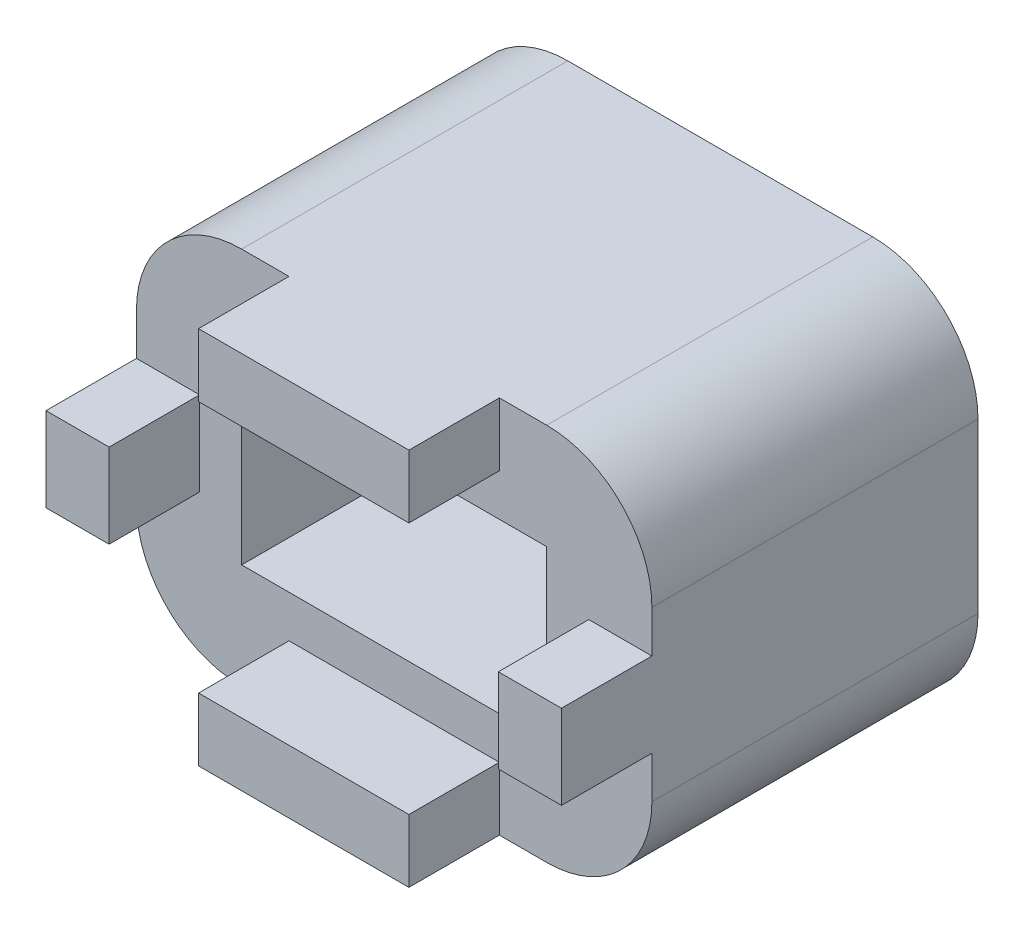
from build123d import *

# Parameters (mm, degrees)
SKETCH1_W           = 24.5
SKETCH1_H           = 18
SKETCH1_W_2         = 14.5
SKETCH1_H_2         = 8
BOSS_EXTRUDE1_DEPTH = 15.5
FILLET1_R           = 5
SKETCH3_W           = 10
SKETCH3_H           = 3
SKETCH3_W_2         = 3
SKETCH3_H_2         = 4
BOSS_EXTRUDE2_DEPTH = 4.3


with BuildPart() as part:
    # Sketch1 → Boss-Extrude1 (new body)
    with BuildSketch(Plane.XY):
        Rectangle(SKETCH1_W, SKETCH1_H)
        Rectangle(SKETCH1_W_2, SKETCH1_H_2, mode=Mode.SUBTRACT)
    extrude(amount=BOSS_EXTRUDE1_DEPTH)

    # Fillet1
    fillet1_edges = [part.edges().sort_by_distance(p)[0] for p in [
        (-12.25, 9, 7.75),
        (12.25, 9, 7.75),
        (12.25, -9, 7.75),
        (-12.25, -9, 7.75),
    ]]
    fillet(fillet1_edges, radius=FILLET1_R)

    # Sketch3 → Boss-Extrude2 (add)
    with BuildSketch(Plane.XY.offset(15.5)):
        with Locations((0, -7.5)):
            Rectangle(SKETCH3_W, SKETCH3_H)
        with Locations((0, 7.5)):
            Rectangle(SKETCH3_W, SKETCH3_H)
        with Locations((-10.75, 0)):
            Rectangle(SKETCH3_W_2, SKETCH3_H_2)
        with Locations((10.75, 0)):
            Rectangle(SKETCH3_W_2, SKETCH3_H_2)
    extrude(amount=BOSS_EXTRUDE2_DEPTH)


solid = part.part
